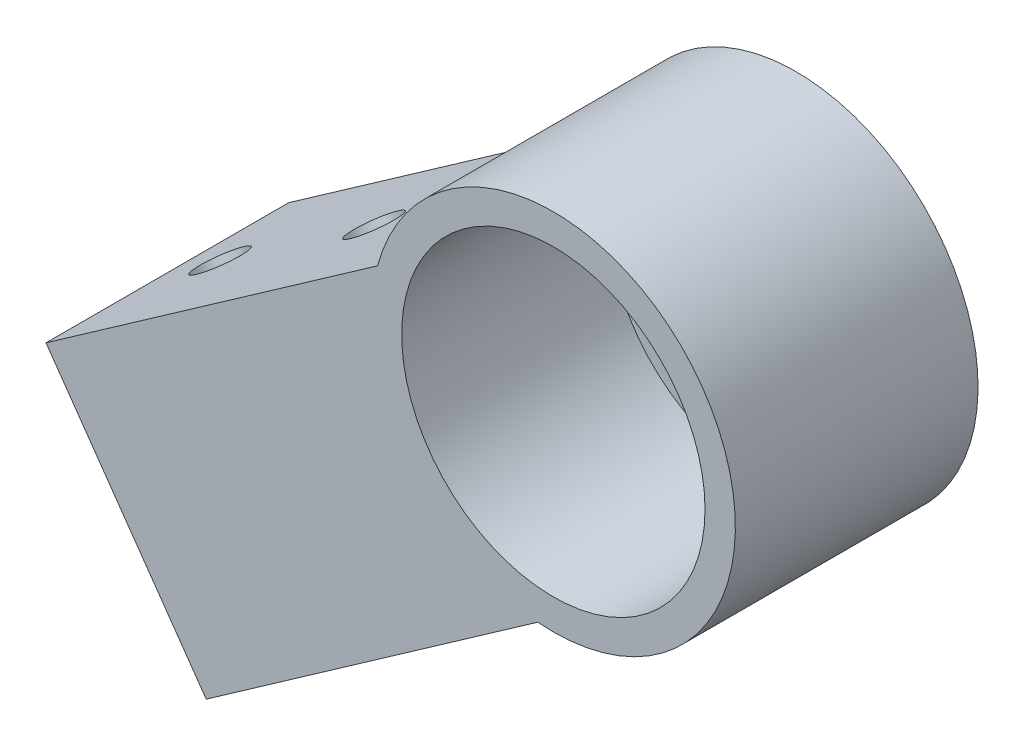
from build123d import *

# Parameters (mm, degrees)
SKETCH1_R           = 15
BOSS_EXTRUDE1_DEPTH = 3
SKETCH2_R           = 15
SKETCH2_R_2         = 12.5
BOSS_EXTRUDE2_DEPTH = 17
SKETCH3_R           = 3
SKETCH3_R_2         = 1.5
CUT_EXTRUDE1_DEPTH  = 3
BOSS_EXTRUDE3_DEPTH = 20
SKETCH6_W           = 13
SKETCH6_H           = 13
CUT_EXTRUDE3_DEPTH  = 26
SKETCH7_R           = 2
CUT_EXTRUDE4_DEPTH  = 58.905178378


with BuildPart() as part:
    # Sketch1 → Boss-Extrude1 (new body)
    with BuildSketch(Plane.XY):
        Circle(SKETCH1_R)
    extrude(amount=BOSS_EXTRUDE1_DEPTH)

    # Sketch2 → Boss-Extrude2 (add)
    with BuildSketch(Plane.XY.offset(3)):
        Circle(SKETCH2_R)
        Circle(SKETCH2_R_2, mode=Mode.SUBTRACT)
    extrude(amount=BOSS_EXTRUDE2_DEPTH)

    # Sketch3 → Cut-Extrude1 (cut)
    with BuildSketch(Plane.XY.offset(3)):
        Circle(SKETCH3_R)
        with Locations((-6.960222154, -4.87906831)):
            Circle(SKETCH3_R_2)
        with Locations((6.960222154, 4.87906831)):
            Circle(SKETCH3_R_2)
    extrude(amount=-CUT_EXTRUDE1_DEPTH, mode=Mode.SUBTRACT)

    # Sketch4 → Boss-Extrude3 (add)
    with BuildSketch(Plane(origin=(0, 0, 0), x_dir=(-1, 0, 0), z_dir=(0, 0, -1))):
        with BuildLine():
            Line((14.487171628, 3.888683351), (41.81162802, -15.265574417))
            Line((41.81162802, -15.265574417), (28.609443183, -34.099116715))
            Line((28.609443183, -34.099116715), (1.284986791, -14.944858947))
            ThreePointArc((1.284986791, -14.944858947), (12.282744977, -8.610120546), (14.487171628, 3.888683351))
        make_face()
    extrude(amount=-BOSS_EXTRUDE3_DEPTH)

    # Sketch6 → Cut-Extrude3 (cut)
    with BuildSketch(Plane(origin=(-35.210535602, -24.682345566, 0), x_dir=(-0.5740080364217665, 0.8188496651542504, 0), z_dir=(-0.8188496651542504, -0.5740080364217665, 0))):
        with Locations((0, -10)):
            Rectangle(SKETCH6_W, SKETCH6_H)
    extrude(amount=-CUT_EXTRUDE3_DEPTH, mode=Mode.SUBTRACT)

    # Sketch7 → Cut-Extrude4 (cut, through all)
    with BuildSketch(Plane(origin=(6.601092419, -9.416771149, 0), x_dir=(0, 0, 1), z_dir=(0.5740080364217666, -0.8188496651542504, 0))):
        with Locations(Location((10, 37.7, 0), (0, 0, 270))):
            Circle(SKETCH7_R)
        with Locations(Location((10, 22.2, 0), (0, 0, 270))):
            Circle(SKETCH7_R)
    extrude(amount=-CUT_EXTRUDE4_DEPTH, mode=Mode.SUBTRACT)


solid = part.part
